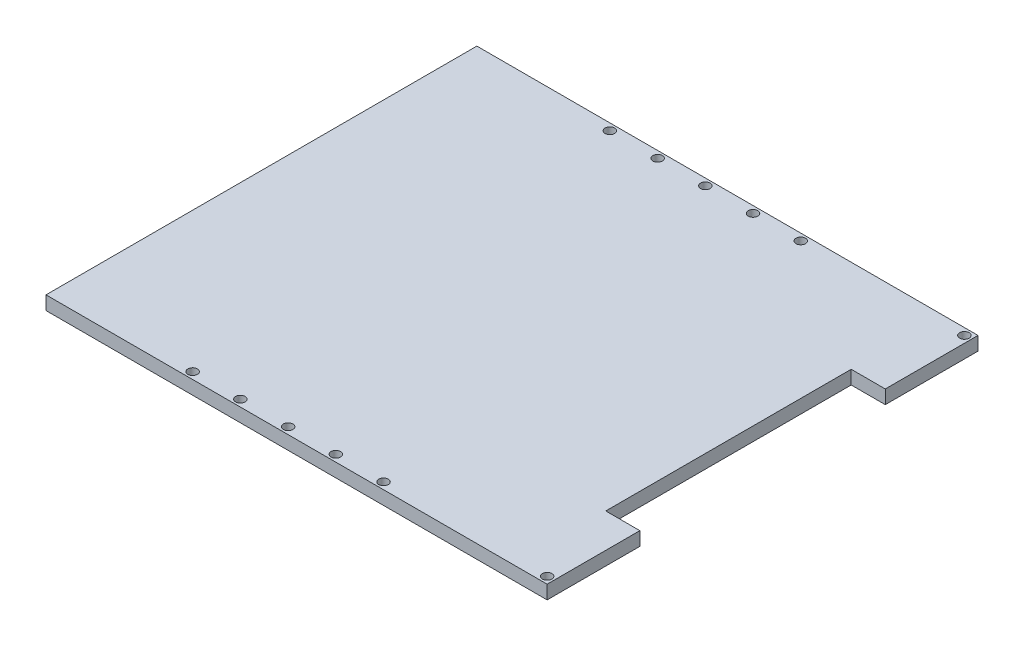
from build123d import *

# Parameters (mm, degrees)
SKETCH1_W           = 183.77
SKETCH1_H           = 158
SKETCH1_R           = 1.75
BOSS_EXTRUDE1_DEPTH = 5
SKETCH2_W           = 25
SKETCH2_H           = 90
CUT_EXTRUDE1_DEPTH  = 10


with BuildPart() as part:
    # Sketch1 → Boss-Extrude1 (new body)
    with BuildSketch(Plane(origin=(0, 0, 0), x_dir=(1, 0, 0), z_dir=(0, 1, 0))):
        Rectangle(SKETCH1_W, SKETCH1_H)
        with Locations(Location((89.385, 76.5, 0), (0, 0, 270))):
            Circle(SKETCH1_R, mode=Mode.SUBTRACT)
        with Locations(Location((29.385, 76.5, 0), (0, 0, 270))):
            Circle(SKETCH1_R, mode=Mode.SUBTRACT)
        with Locations(Location((11.885, 76.5, 0), (0, 0, 270))):
            Circle(SKETCH1_R, mode=Mode.SUBTRACT)
        with Locations(Location((-5.615, 76.5, 0), (0, 0, 270))):
            Circle(SKETCH1_R, mode=Mode.SUBTRACT)
        with Locations(Location((-23.115, 76.5, 0), (0, 0, 270))):
            Circle(SKETCH1_R, mode=Mode.SUBTRACT)
        with Locations(Location((-40.615, 76.5, 0), (0, 0, 270))):
            Circle(SKETCH1_R, mode=Mode.SUBTRACT)
        with Locations(Location((89.385, -76.5, 0), (0, 0, 270))):
            Circle(SKETCH1_R, mode=Mode.SUBTRACT)
        with Locations(Location((29.385, -76.5, 0), (0, 0, 270))):
            Circle(SKETCH1_R, mode=Mode.SUBTRACT)
        with Locations(Location((11.885, -76.5, 0), (0, 0, 270))):
            Circle(SKETCH1_R, mode=Mode.SUBTRACT)
        with Locations(Location((-5.615, -76.5, 0), (0, 0, 270))):
            Circle(SKETCH1_R, mode=Mode.SUBTRACT)
        with Locations(Location((-23.115, -76.5, 0), (0, 0, 270))):
            Circle(SKETCH1_R, mode=Mode.SUBTRACT)
        with Locations(Location((-40.615, -76.5, 0), (0, 0, 270))):
            Circle(SKETCH1_R, mode=Mode.SUBTRACT)
    extrude(amount=BOSS_EXTRUDE1_DEPTH)

    # Sketch2 → Cut-Extrude1 (cut)
    with BuildSketch(Plane(origin=(0, 5, 0), x_dir=(1, 0, 0), z_dir=(0, 1, 0))):
        with Locations((91.885, 0)):
            Rectangle(SKETCH2_W, SKETCH2_H)
    extrude(amount=-CUT_EXTRUDE1_DEPTH, mode=Mode.SUBTRACT)


solid = part.part
